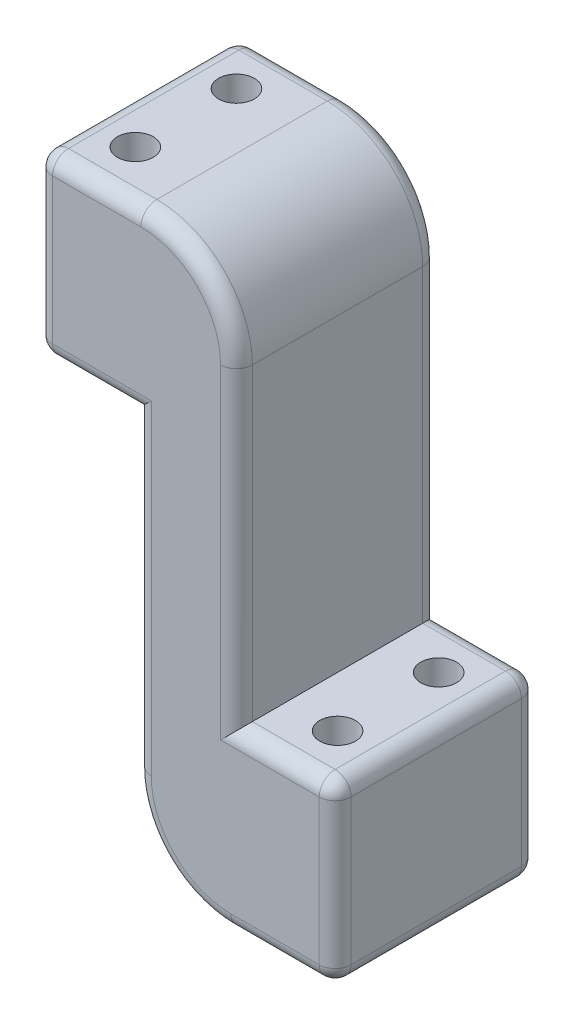
from build123d import *

# Parameters (mm, degrees)
BOSS_EXTRUDE1_DEPTH = 25.4
SKETCH2_R           = 2.25
CUT_EXTRUDE1_DEPTH  = 86.94795537
FILLET1_R           = 2


with BuildPart() as part:
    # Sketch1 → Boss-Extrude1 (new body)
    with BuildSketch(Plane.XY):
        with BuildLine():
            Line((-12.3952, 38.8), (-12.3952, 0))
            Line((-12.3952, 0), (-12.3952, -22.2504))
            Line((-12.3952, -22.2504), (-13.0952, -22.2504))
            ThreePointArc((-13.0952, -22.2504), (-21.580481374, -18.735681374), (-25.0952, -10.2504))
            Line((-25.0952, -10.2504), (-25.0952, 28.5496))
            Line((-25.0952, 28.5496), (-25.0952, 50.8))
            Line((-25.0952, 50.8), (-24.3952, 50.8))
            ThreePointArc((-24.3952, 50.8), (-15.909918626, 47.285281374), (-12.3952, 38.8))
        make_face()
        with BuildLine():
            ThreePointArc((-37.4904, 48.8), (-36.904613562, 50.214213562), (-35.4904, 50.8))
            Line((-35.4904, 50.8), (-25.0952, 50.8))
            Line((-25.0952, 50.8), (-25.0952, 28.5496))
            Line((-25.0952, 28.5496), (-35.4904, 28.5496))
            ThreePointArc((-35.4904, 28.5496), (-36.904613562, 29.135386438), (-37.4904, 30.5496))
            Line((-37.4904, 30.5496), (-37.4904, 48.8))
        make_face()
        with BuildLine():
            ThreePointArc((0, -20.2504), (-0.585786438, -21.664613562), (-2, -22.2504))
            Line((-2, -22.2504), (-12.3952, -22.2504))
            Line((-12.3952, -22.2504), (-12.3952, 0))
            Line((-12.3952, 0), (-2, 0))
            ThreePointArc((-2, 0), (-0.585786438, -0.585786438), (0, -2))
            Line((0, -2), (0, -20.2504))
        make_face()
    extrude(amount=BOSS_EXTRUDE1_DEPTH)

    # Sketch2 → Cut-Extrude1 (cut, through all)
    with BuildSketch(Plane(origin=(0, 50.8, 0), x_dir=(1, 0, 0), z_dir=(0, 1, 0))):
        with Locations(Location((-31.4452, -6.35, 0), (0, 0, 270))):
            Circle(SKETCH2_R)
        with Locations(Location((-31.4452, -19.05, 0), (0, 0, 270))):
            Circle(SKETCH2_R)
        with Locations(Location((-6.0452, -6.35, 0), (0, 0, 270))):
            Circle(SKETCH2_R)
        with Locations(Location((-6.0452, -19.05, 0), (0, 0, 270))):
            Circle(SKETCH2_R)
    extrude(amount=-CUT_EXTRUDE1_DEPTH, mode=Mode.SUBTRACT)

    # Fillet1
    fillet1_edges = [part.edges().sort_by_distance(p)[0] for p in [
        (-15.909918626, 47.285281374, 25.4),
        (-29.9428, 50.8, 25.4),
        (-7.1976, 0, 0),
        (-0.585786438, -0.585786438, 0),
        (0, -11.1252, 0),
        (-0.585786438, -21.664613562, 0),
        (-7.5476, -22.2504, 0),
        (-21.580481374, -18.735681374, 0),
        (-25.0952, 9.1496, 0),
        (-30.2928, 28.5496, 0),
        (-36.904613562, 29.135386438, 0),
        (-37.4904, 39.6748, 0),
        (-36.904613562, 50.214213562, 0),
        (-29.9428, 50.8, 0),
        (-15.909918626, 47.285281374, 0),
        (-36.904613562, 50.214213562, 25.4),
        (-12.3952, 19.4, 0),
        (-37.4904, 39.6748, 25.4),
        (-36.904613562, 29.135386438, 25.4),
        (-30.2928, 28.5496, 25.4),
        (-25.0952, 9.1496, 25.4),
        (-21.580481374, -18.735681374, 25.4),
        (-12.3952, 19.4, 25.4),
        (-7.5476, -22.2504, 25.4),
        (-0.585786438, -21.664613562, 25.4),
        (0, -11.1252, 25.4),
        (-0.585786438, -0.585786438, 25.4),
        (-7.1976, 0, 25.4),
    ]]
    fillet(fillet1_edges, radius=FILLET1_R)


solid = part.part
